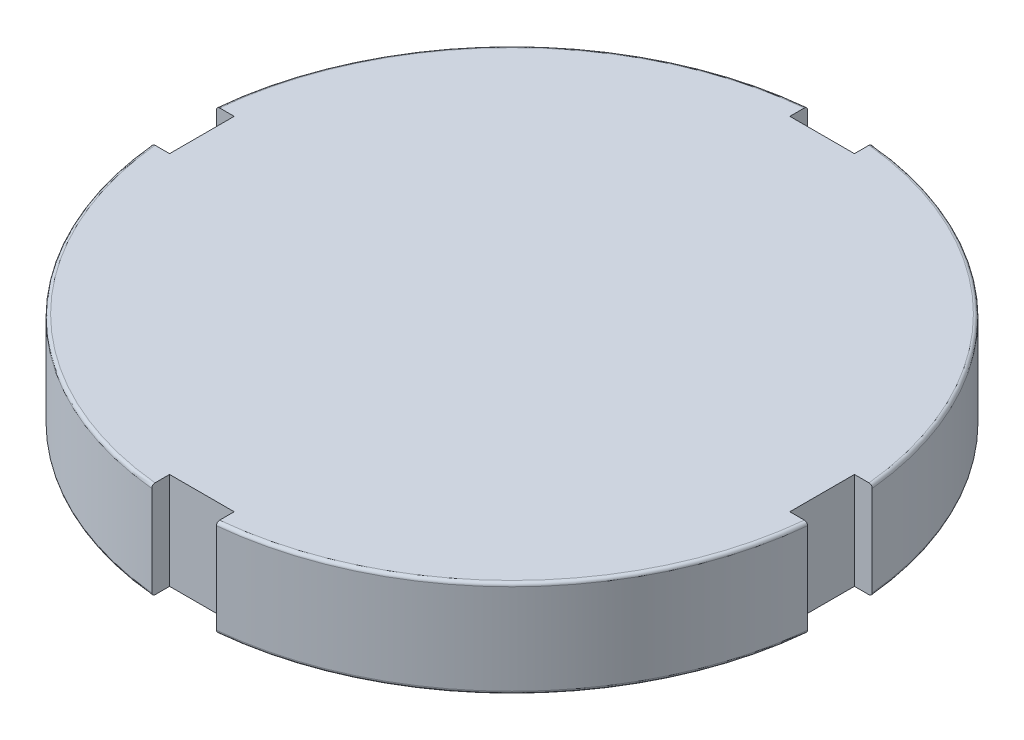
from build123d import *

# Parameters (mm, degrees)
SKETCH2_R           = 64.77
BOSS_EXTRUDE1_DEPTH = 19.05
FILLET1_R           = 0.635
SKETCH4_W           = 12.7
SKETCH4_H           = 9.0994385
SKETCH4_W_2         = 9.0994385
SKETCH4_H_2         = 12.7
CUT_EXTRUDE2_DEPTH  = 94.558582252


with BuildPart() as part:
    # Sketch2 → Boss-Extrude1 (new body)
    with BuildSketch(Plane(origin=(0, 0, 0), x_dir=(1, 0, 0), z_dir=(0, 1, 0))):
        with Locations(Location((0, 0, 0), (0, 0, 90))):
            Circle(SKETCH2_R)
    extrude(amount=BOSS_EXTRUDE1_DEPTH)

    # Fillet1
    fillet1_edges = [part.edges().sort_by_distance(p)[0] for p in [
        (0, 0, 64.77),
        (0, 19.05, 64.77),
    ]]
    fillet(fillet1_edges, radius=FILLET1_R)

    # Sketch4 → Cut-Extrude2 (cut, through all)
    with BuildSketch(Plane.XZ):
        with Locations((0, -65.50971925)):
            Rectangle(SKETCH4_W, SKETCH4_H)
        with Locations((-65.50971925, 0)):
            Rectangle(SKETCH4_W_2, SKETCH4_H_2)
        with Locations((0, 65.50971925)):
            Rectangle(SKETCH4_W, SKETCH4_H)
        with Locations((65.50971925, 0)):
            Rectangle(SKETCH4_W_2, SKETCH4_H_2)
    extrude(amount=-CUT_EXTRUDE2_DEPTH, mode=Mode.SUBTRACT)


solid = part.part
